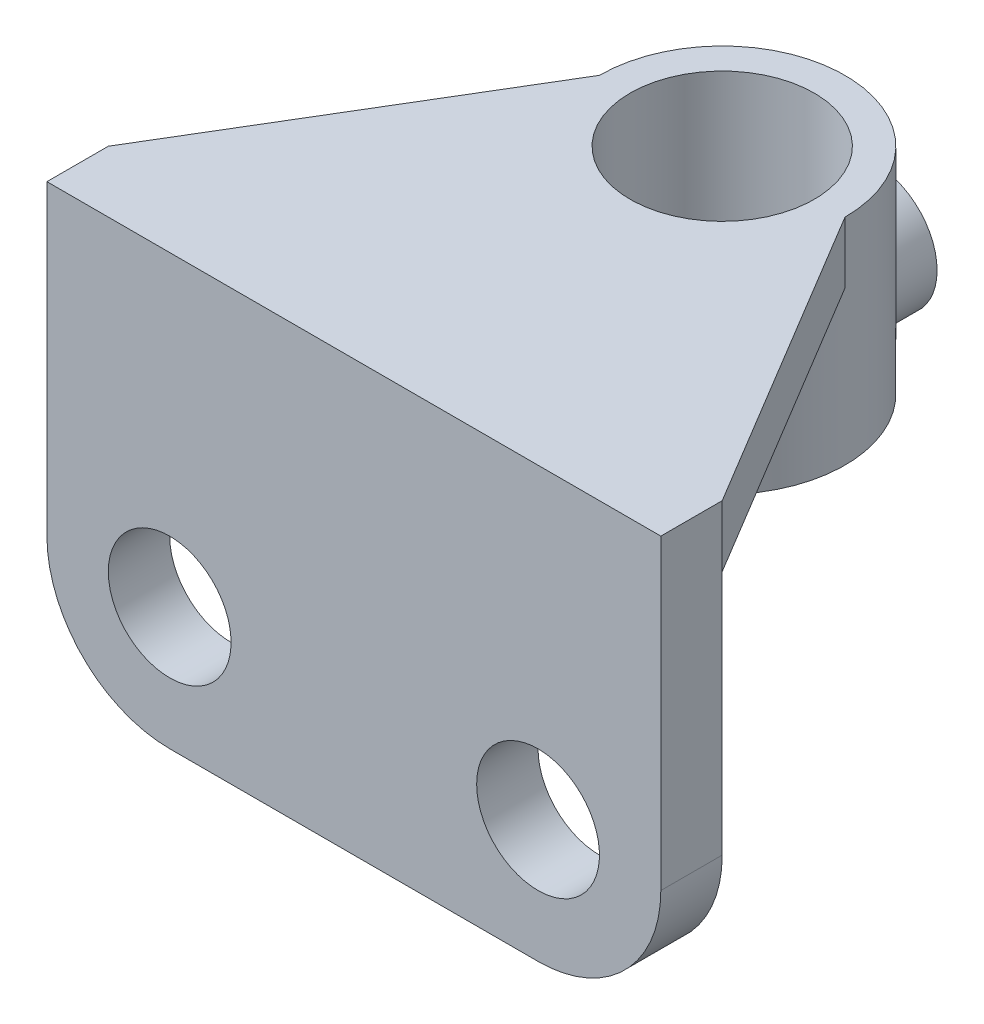
from build123d import *

# Parameters (mm, degrees)
EXTRUDE_1_DEPTH     = 10
SKETCH_2_R          = 10
CUT_EXTRUDE_1_DEPTH = 62.846584384
SKETCH_3_R          = 20
SKETCH_3_R_2        = 15
EXTRUDE_2_DEPTH     = 35
EXTRUDE_3_DEPTH     = 10
EXTRUDE_4_REACH     = 119.473
CUT_EXTRUDE_3_DEPTH = 10
EXTRUDE_5_DEPTH     = 10


with BuildPart() as part:
    # 草圖1 → 填料-伸長1 (new body)
    with BuildSketch(Plane.XY):
        with BuildLine():
            Line((50, 35), (-50, 35))
            Line((-50, 35), (-50, -15))
            ThreePointArc((-50, -15), (-44.142135624, -29.142135624), (-30, -35))
            Line((-30, -35), (30, -35))
            ThreePointArc((30, -35), (44.142135624, -29.142135624), (50, -15))
            Line((50, -15), (50, 35))
        make_face()
    extrude(amount=-EXTRUDE_1_DEPTH)

    # 草圖2 → 除料-伸長1 (cut, through all)
    with BuildSketch(Plane(origin=(0, 0, -10), x_dir=(-1, 0, 0), z_dir=(0, 0, -1))):
        with Locations((-30, -15)):
            Circle(SKETCH_2_R)
        with Locations((30, -15)):
            Circle(SKETCH_2_R)
    extrude(amount=-CUT_EXTRUDE_1_DEPTH, mode=Mode.SUBTRACT)



with BuildPart() as body_2:
    # 草圖3 → 填料-伸長2 (new body)
    with BuildSketch(Plane(origin=(0, 35, 0), x_dir=(1, 0, 0), z_dir=(0, 1, 0))):
        with Locations(Location((0, 60, 0), (0, 0, 180))):
            Circle(SKETCH_3_R)
        with Locations(Location((0, 60, 0), (0, 0, 180))):
            Circle(SKETCH_3_R_2, mode=Mode.SUBTRACT)
    extrude(amount=-EXTRUDE_2_DEPTH)


with BuildPart() as part_1:
    add(part.part)

    add(body_2.part)  # 填料-伸長3 merges body 2
    # 草圖4 → 填料-伸長3 (add)
    with BuildSketch(Plane(origin=(0, 35, 0), x_dir=(1, 0, 0), z_dir=(0, 1, 0))):
        with BuildLine():
            Line((-20, 60), (-50, 10))
            Line((-50, 10), (50, 10))
            Line((50, 10), (20, 60))
            ThreePointArc((20, 60), (0, 40), (-20, 60))
        make_face()
    extrude(amount=-EXTRUDE_3_DEPTH)

    # 填料-伸長4: up to this face of the body (flat: up to its plane)
    extrude_4_end = Plane(part_1.part.faces().sort_by_distance((0, 25, -27.034412528))[0])
    # 草圖6 → 填料-伸長4 (add, up to the picked face)
    with BuildSketch(Plane.XZ.offset(35), mode=Mode.PRIVATE) as extrude_4_sk1:
        with BuildLine():
            Line((5, -40.635083269), (5, -10))
            Line((5, -10), (0, -10))
            Line((0, -10), (-5, -10))
            Line((-5, -10), (-5, -40.635083269))
            ThreePointArc((-5, -40.635083269), (0, -40), (5, -40.635083269))
        make_face()
    extrude_4_tool1 = split(extrude(extrude_4_sk1.sketch, amount=-EXTRUDE_4_REACH, mode=Mode.PRIVATE), bisect_by=extrude_4_end, keep=Keep.BOTH, mode=Mode.PRIVATE)
    add(extrude_4_tool1.solids().sort_by(Axis((0, -35, -25.105756), (0, 1, 0)))[0])

    # 草圖7 → 除料-伸長3 (cut)
    with BuildSketch(Plane.ZY.offset(5)):
        Polygon((-10, -35), (-40.635083269, 0), (-40.635083269, -35), align=None)
    extrude(amount=-CUT_EXTRUDE_3_DEPTH, mode=Mode.SUBTRACT)

    # 草圖8 → 填料-伸長5 (add)
    # profile 1 of 2: a face of its own
    with BuildSketch(Plane.XY.offset(-85)):
        with BuildLine():
            ThreePointArc((10, 10), (-7.071067812, 17.071067812), (0, 0))
            ThreePointArc((0, 0), (7.071067812, 2.928932188), (10, 10))
        make_face()
        with BuildLine():
            ThreePointArc((7, 10), (4.949747468, 5.050252532), (0, 3))
            ThreePointArc((0, 3), (-4.949747468, 14.949747468), (7, 10))
        make_face(mode=Mode.SUBTRACT)
    # profile 2 of 2: a face of its own
    with BuildSketch(Plane.XY.offset(-85)):
        with BuildLine():
            ThreePointArc((10, 10), (-7.071067812, 17.071067812), (0, 0))
            ThreePointArc((0, 0), (7.071067812, 2.928932188), (10, 10))
        make_face()
        with BuildLine():
            ThreePointArc((7, 10), (4.949747468, 5.050252532), (0, 3))
            ThreePointArc((0, 3), (-4.949747468, 14.949747468), (7, 10))
        make_face(mode=Mode.SUBTRACT)
    extrude(amount=EXTRUDE_5_DEPTH)


solid = part_1.part
